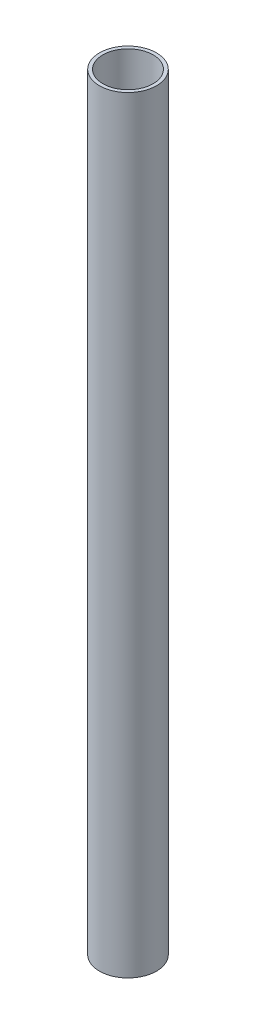
from build123d import *

# Parameters (mm, degrees)
SKETCH1_R           = 12.5
SKETCH1_R_2         = 11
BOSS_EXTRUDE1_DEPTH = 336.16


with BuildPart() as part:
    # Sketch1 → Boss-Extrude1 (new body)
    with BuildSketch(Plane(origin=(0, 0, 0), x_dir=(1, 0, 0), z_dir=(0, 1, 0))):
        with Locations(Location((0, 0, 0), (0, 0, 270))):
            Circle(SKETCH1_R)
        with Locations(Location((0, 0, 0), (0, 0, 270))):
            Circle(SKETCH1_R_2, mode=Mode.SUBTRACT)
    extrude(amount=BOSS_EXTRUDE1_DEPTH)


solid = part.part
